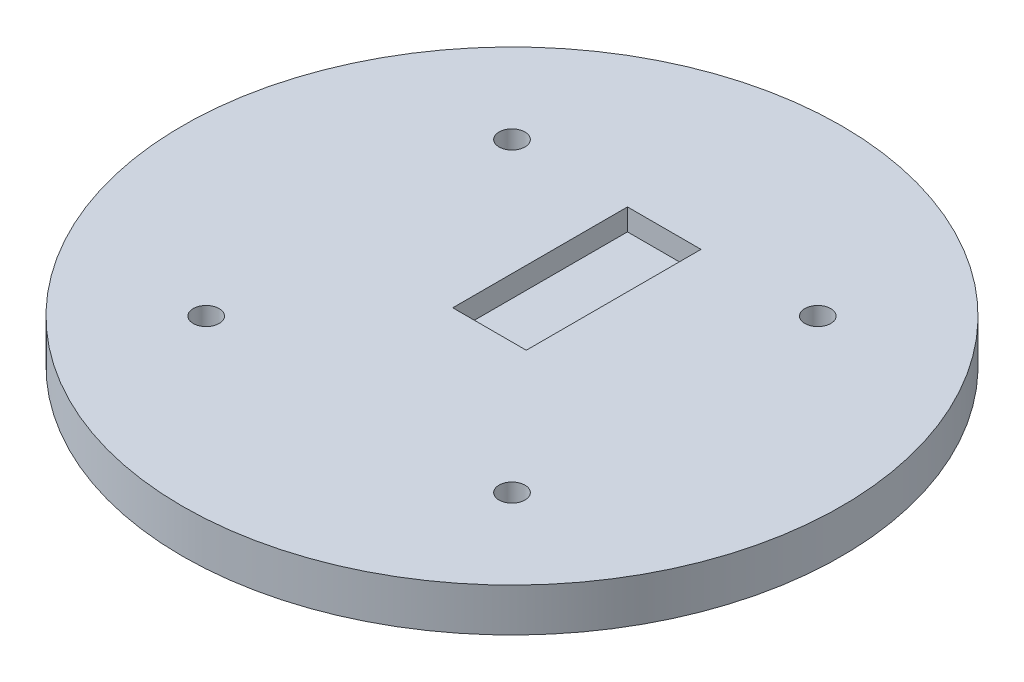
from build123d import *

# Parameters (mm, degrees)
SKETCH1_R           = 38.1
BOSS_EXTRUDE1_DEPTH = 5
SKETCH3_W           = 8.5
SKETCH3_H           = 20.2
CUT_EXTRUDE2_DEPTH  = 2.5
SKETCH4_W           = 5
SKETCH4_H           = 2
CUT_EXTRUDE4_DEPTH  = 54.939503149
SKETCH5_R           = 1.5
CUT_EXTRUDE5_DEPTH  = 3
SKETCH6_R           = 2.5
CUT_EXTRUDE6_DEPTH  = 3


with BuildPart() as part:
    # Sketch1 → Boss-Extrude1 (new body)
    with BuildSketch(Plane(origin=(0, 0, 0), x_dir=(1, 0, 0), z_dir=(0, 1, 0))):
        with Locations(Location((0, 0, 0), (0, 0, 270))):
            Circle(SKETCH1_R)
    extrude(amount=BOSS_EXTRUDE1_DEPTH)

    # Sketch3 → Cut-Extrude2 (cut)
    with BuildSketch(Plane(origin=(0, 5, 0), x_dir=(1, 0, 0), z_dir=(0, 1, 0))):
        with Locations((0, 7.5)):
            Rectangle(SKETCH3_W, SKETCH3_H)
    extrude(amount=-CUT_EXTRUDE2_DEPTH, mode=Mode.SUBTRACT)

    # Sketch4 → Cut-Extrude4 (cut, through all)
    with BuildSketch(Plane(origin=(0, 2.5, 0), x_dir=(1, 0, 0), z_dir=(0, 1, 0))):
        with Locations((0, -1.6)):
            Rectangle(SKETCH4_W, SKETCH4_H)
    extrude(amount=-CUT_EXTRUDE4_DEPTH, mode=Mode.SUBTRACT)

    # Sketch5 → Cut-Extrude5 (cut)
    with BuildSketch(Plane(origin=(0, 5, 0), x_dir=(1, 0, 0), z_dir=(0, 1, 0))):
        with Locations(Location((17.67766953, 17.67766953, 0), (0, 0, 270))):
            Circle(SKETCH5_R)
        with Locations(Location((-17.67766953, 17.67766953, 0), (0, 0, 270))):
            Circle(SKETCH5_R)
        with Locations(Location((-17.67766953, -17.67766953, 0), (0, 0, 270))):
            Circle(SKETCH5_R)
        with Locations(Location((17.67766953, -17.67766953, 0), (0, 0, 270))):
            Circle(SKETCH5_R)
    extrude(amount=-CUT_EXTRUDE5_DEPTH, mode=Mode.SUBTRACT)

    # Sketch6 → Cut-Extrude6 (cut)
    with BuildSketch(Plane.XZ):
        with Locations(Location((0, -33.1, 0), (0, 0, 270))):
            Circle(SKETCH6_R)
        with Locations(Location((33.1, 0, 0), (0, 0, 270))):
            Circle(SKETCH6_R)
        with Locations(Location((0, 33.1, 0), (0, 0, 270))):
            Circle(SKETCH6_R)
        with Locations(Location((-33.1, 0, 0), (0, 0, 270))):
            Circle(SKETCH6_R)
    extrude(amount=-CUT_EXTRUDE6_DEPTH, mode=Mode.SUBTRACT)


solid = part.part
